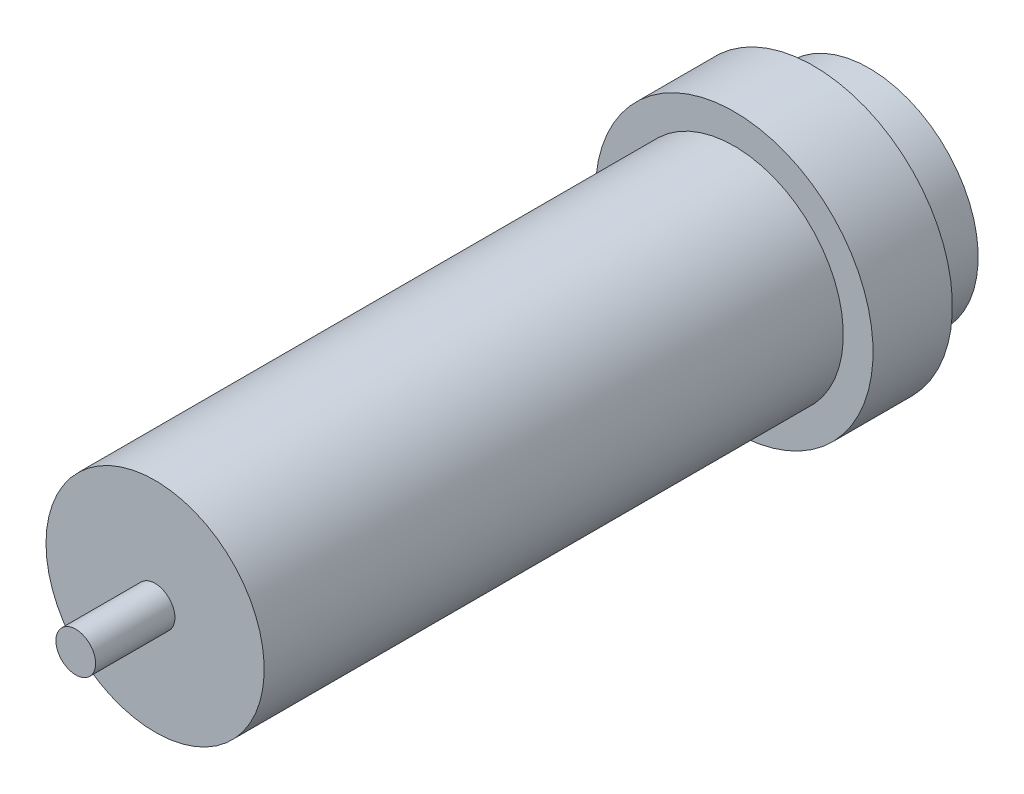
from build123d import *

# Parameters (mm, degrees)
SKETCH1_R                = 5
BOSS_EXTRUDE1_DEPTH      = 10
SKETCH2_R                = 27.5
BOSS_EXTRUDE2_DEPTH      = 180
BOSS_EXTRUDE3_DEPTH      = 10
BOSS_EXTRUDE3_DEPTH_BACK = 10
SKETCH3_R                = 35
SKETCH5_R                = 5
BOSS_EXTRUDE4_DEPTH      = 20


with BuildPart() as part:
    # Sketch1 → Boss-Extrude1 (new body)
    with BuildSketch(Plane.XY):
        Circle(SKETCH1_R)
    extrude(amount=BOSS_EXTRUDE1_DEPTH)

    # Sketch2 → Boss-Extrude2 (add)
    with BuildSketch(Plane.XY.offset(10)):
        with Locations(Location((0, 0, 0), (0, 0, 180))):
            Circle(SKETCH2_R)
    extrude(amount=BOSS_EXTRUDE2_DEPTH)

    # Sketch3 → Boss-Extrude3 (add, two sides: drawn at the far end of the back side and taken through both)
    with BuildSketch(Plane(origin=(0, 0, 34), x_dir=(-1, 0, 0), z_dir=(0, 0, -1)).offset(-BOSS_EXTRUDE3_DEPTH_BACK)):
        Circle(SKETCH3_R)
    extrude(amount=BOSS_EXTRUDE3_DEPTH + BOSS_EXTRUDE3_DEPTH_BACK)

    # Sketch5 → Boss-Extrude4 (add)
    with BuildSketch(Plane.XY.offset(190)):
        Circle(SKETCH5_R)
    extrude(amount=BOSS_EXTRUDE4_DEPTH)


solid = part.part
